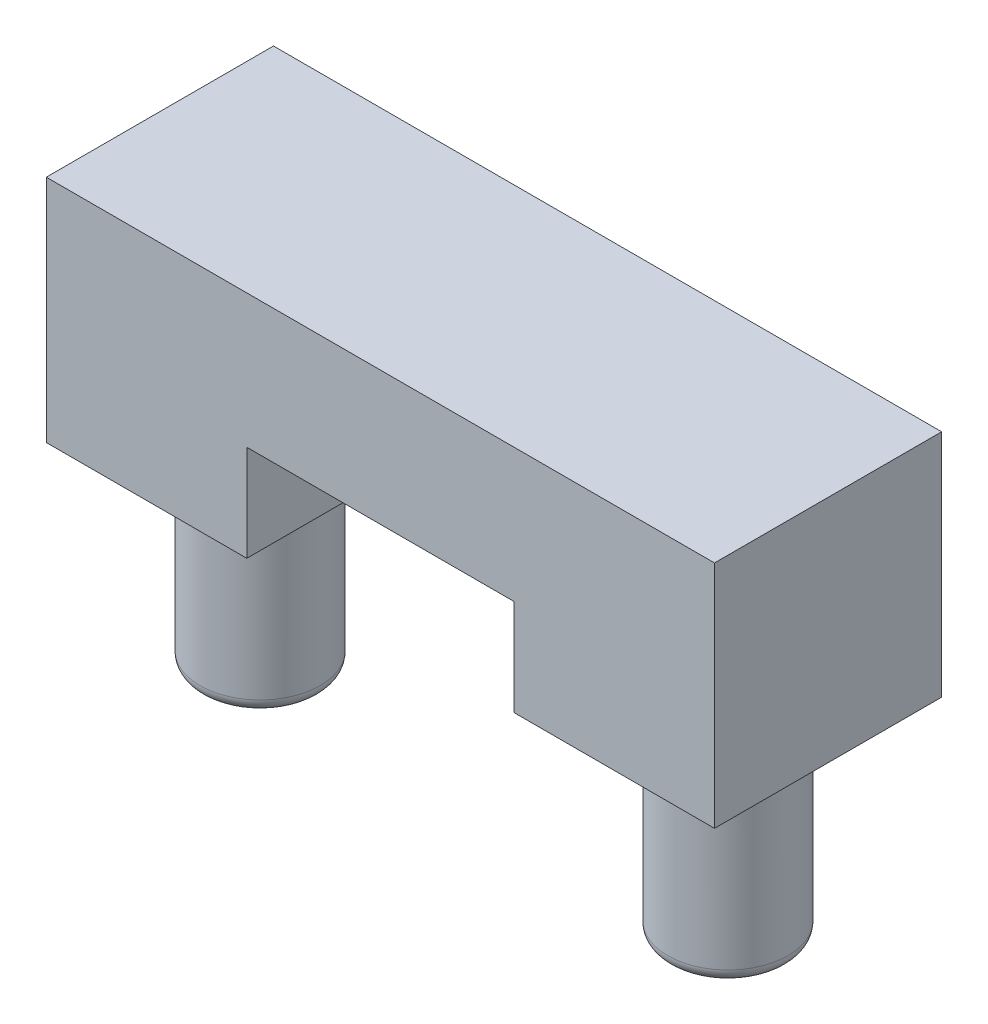
from build123d import *

# Parameters (mm, degrees)
SKETCH1_W           = 50
SKETCH1_H           = 17
BOSS_EXTRUDE1_DEPTH = 10
SKETCH2_W           = 15
SKETCH2_H           = 17
BOSS_EXTRUDE2_DEPTH = 7.2
SKETCH3_R           = 4.5
BOSS_EXTRUDE3_DEPTH = 15
FILLET1_R           = 1


with BuildPart() as part:
    # Sketch1 → Boss-Extrude1 (new body)
    with BuildSketch(Plane(origin=(0, 0, 0), x_dir=(1, 0, 0), z_dir=(0, 1, 0))):
        Rectangle(SKETCH1_W, SKETCH1_H)
    extrude(amount=BOSS_EXTRUDE1_DEPTH)

    # Sketch2 → Boss-Extrude2 (add)
    with BuildSketch(Plane.XZ):
        with Locations((-17.5, 0)):
            Rectangle(SKETCH2_W, SKETCH2_H)
        with Locations((17.5, 0)):
            Rectangle(SKETCH2_W, SKETCH2_H)
    extrude(amount=BOSS_EXTRUDE2_DEPTH)

    # Sketch3 → Boss-Extrude3 (add)
    with BuildSketch(Plane.XZ.offset(7.2)):
        with Locations(Location((-17.5, 0, 0), (0, 0, 90))):
            Circle(SKETCH3_R)
        with Locations(Location((17.5, 0, 0), (0, 0, 90))):
            Circle(SKETCH3_R)
    extrude(amount=BOSS_EXTRUDE3_DEPTH)

    # Fillet1
    fillet1_edges = [part.edges().sort_by_distance(p)[0] for p in [
        (-17.5, -22.2, -4.5),
        (17.5, -22.2, -4.5),
    ]]
    fillet(fillet1_edges, radius=FILLET1_R)


solid = part.part
